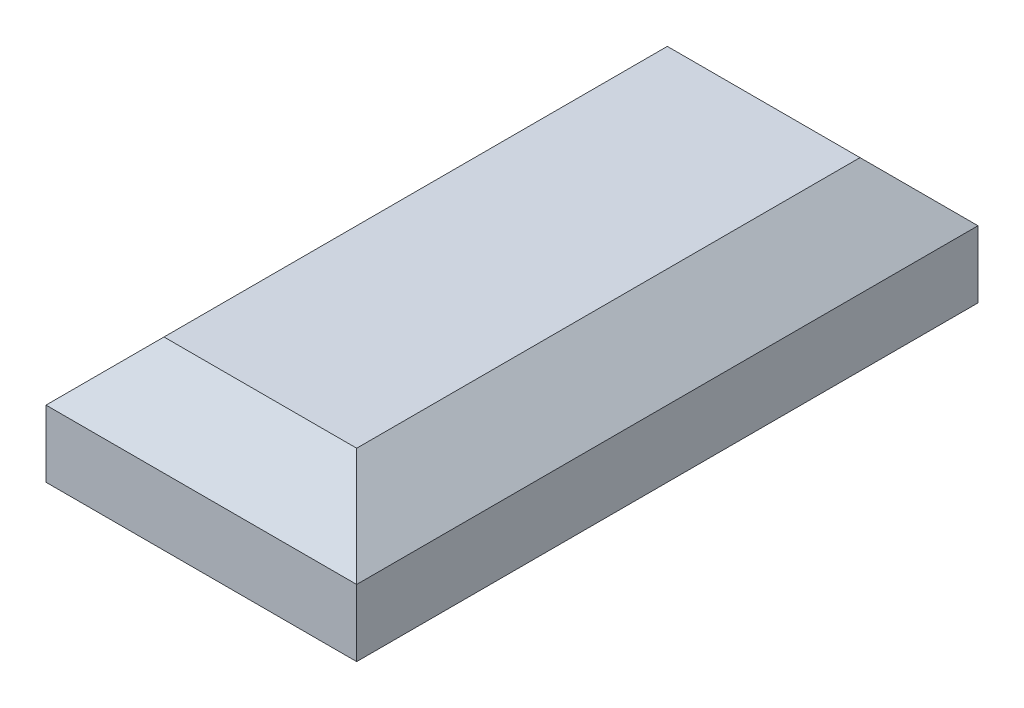
from build123d import *

# Parameters (mm, degrees)
MAINBASESKETCH_W      = 7.9
MAINBASESKETCH_H      = 3.2
MAINBASEEXTRUDE_DEPTH = 7.9
MAINBASESHELL_T       = -1.2
CHAMFER1_SIZE         = 1.5


with BuildPart() as part:
    # MainBaseSketch → MainBaseExtrude (new, symmetric)
    with BuildSketch(Plane.XY):
        with Locations((4.631967213, 1.6)):
            Rectangle(MAINBASESKETCH_W, MAINBASESKETCH_H)
    extrude(amount=MAINBASEEXTRUDE_DEPTH, both=True)

    # MainBaseShell
    mainbaseshell_openings = [part.faces().sort_by_distance(p)[0] for p in [
        (4.631967213, 0, 0),
    ]]
    offset(amount=MAINBASESHELL_T, openings=mainbaseshell_openings, kind=Kind.INTERSECTION)

    # Chamfer1
    chamfer1_edges = [part.edges().sort_by_distance(p)[0] for p in [
        (4.631967213, 3.2, 7.9),
        (4.631967213, 3.2, -7.9),
        (0.681967213, 3.2, 0),
        (8.581967213, 3.2, 0),
    ]]
    chamfer(chamfer1_edges, length=CHAMFER1_SIZE)


solid = part.part
